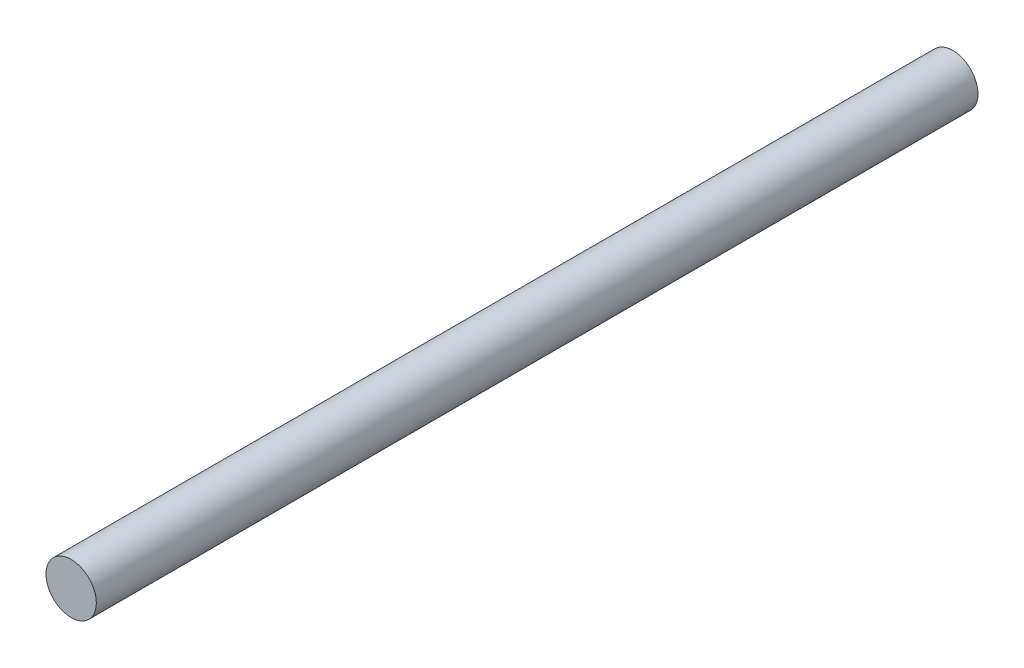
from build123d import *

# Parameters (mm, degrees)
SKETCH1_R           = 1
BOSS_EXTRUDE1_DEPTH = 35


with BuildPart() as part:
    # Sketch1 → Boss-Extrude1 (new body)
    with BuildSketch(Plane.XY):
        Circle(SKETCH1_R)
    extrude(amount=BOSS_EXTRUDE1_DEPTH)


solid = part.part
